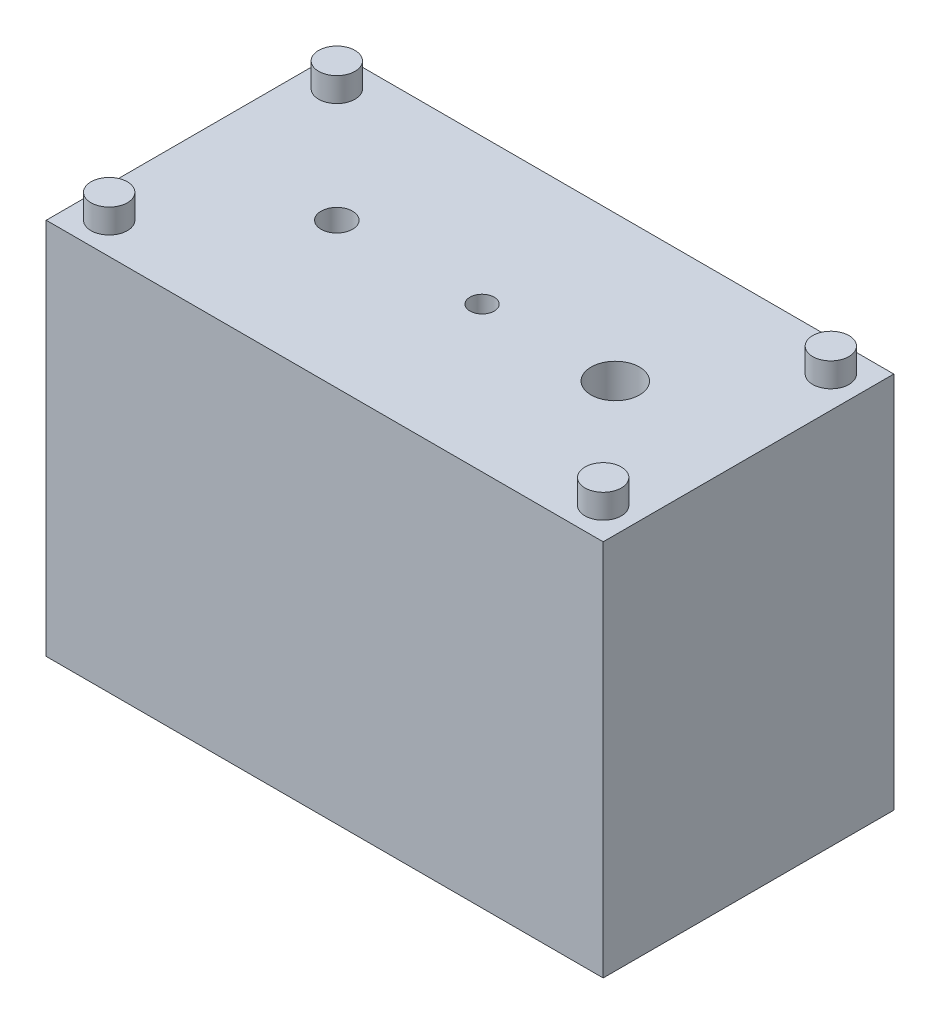
from build123d import *

# Parameters (mm, degrees)
SKETCH1_W           = 23
SKETCH1_H           = 12
BOSS_EXTRUDE1_DEPTH = 15.6
SKETCH2_R           = 0.75
BOSS_EXTRUDE2_DEPTH = 1
SKETCH3_R           = 1
SKETCH3_R_2         = 0.5
SKETCH3_R_3         = 0.65
CUT_EXTRUDE1_DEPTH  = 4


with BuildPart() as part:
    # Sketch1 → Boss-Extrude1 (new body)
    with BuildSketch(Plane(origin=(0, 0, 0), x_dir=(1, 0, 0), z_dir=(0, 1, 0))):
        Rectangle(SKETCH1_W, SKETCH1_H)
    extrude(amount=BOSS_EXTRUDE1_DEPTH)

    # Sketch2 → Boss-Extrude2 (add)
    with BuildSketch(Plane(origin=(0, 15.6, 0), x_dir=(1, 0, 0), z_dir=(0, 1, 0))):
        with Locations(Location((-10.2, 4.7, 0), (0, 0, 270))):
            Circle(SKETCH2_R)
        with Locations(Location((10.2, 4.7, 0), (0, 0, 90))):
            Circle(SKETCH2_R)
        with Locations(Location((10.2, -4.7, 0), (0, 0, 270))):
            Circle(SKETCH2_R)
        with Locations(Location((-10.2, -4.7, 0), (0, 0, 90))):
            Circle(SKETCH2_R)
    extrude(amount=BOSS_EXTRUDE2_DEPTH)

    # Sketch3 → Cut-Extrude1 (cut)
    with BuildSketch(Plane(origin=(0, 15.6, 0), x_dir=(1, 0, 0), z_dir=(0, 1, 0))):
        with Locations(Location((6, 0, 0), (0, 0, 270))):
            Circle(SKETCH3_R)
        with Locations(Location((0.5, 0, 0), (0, 0, 270))):
            Circle(SKETCH3_R_2)
        with Locations(Location((-5.5, 0, 0), (0, 0, 270))):
            Circle(SKETCH3_R_3)
    extrude(amount=-CUT_EXTRUDE1_DEPTH, mode=Mode.SUBTRACT)


solid = part.part
